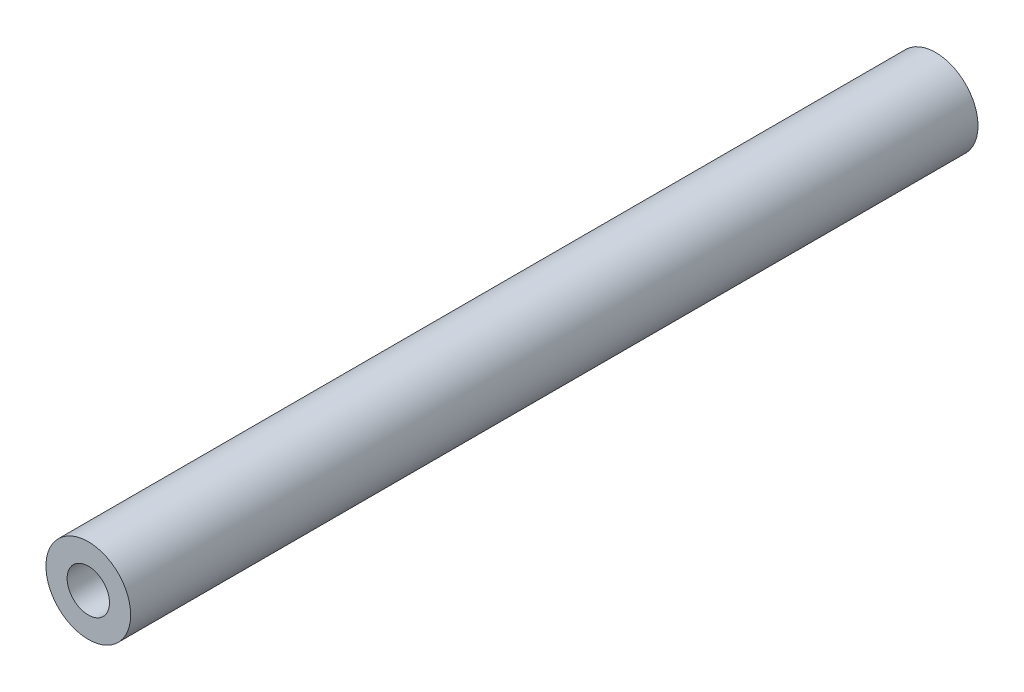
from build123d import *

# Parameters (mm, degrees)
SKETCH_2_R      = 5
SKETCH_2_R_2    = 2.5
EXTRUDE_1_DEPTH = 100


with BuildPart() as part:
    # 草图2 → 凸台-拉伸1 (new body)
    with BuildSketch(Plane.XY):
        Circle(SKETCH_2_R)
        Circle(SKETCH_2_R_2, mode=Mode.SUBTRACT)
    extrude(amount=EXTRUDE_1_DEPTH)


solid = part.part
